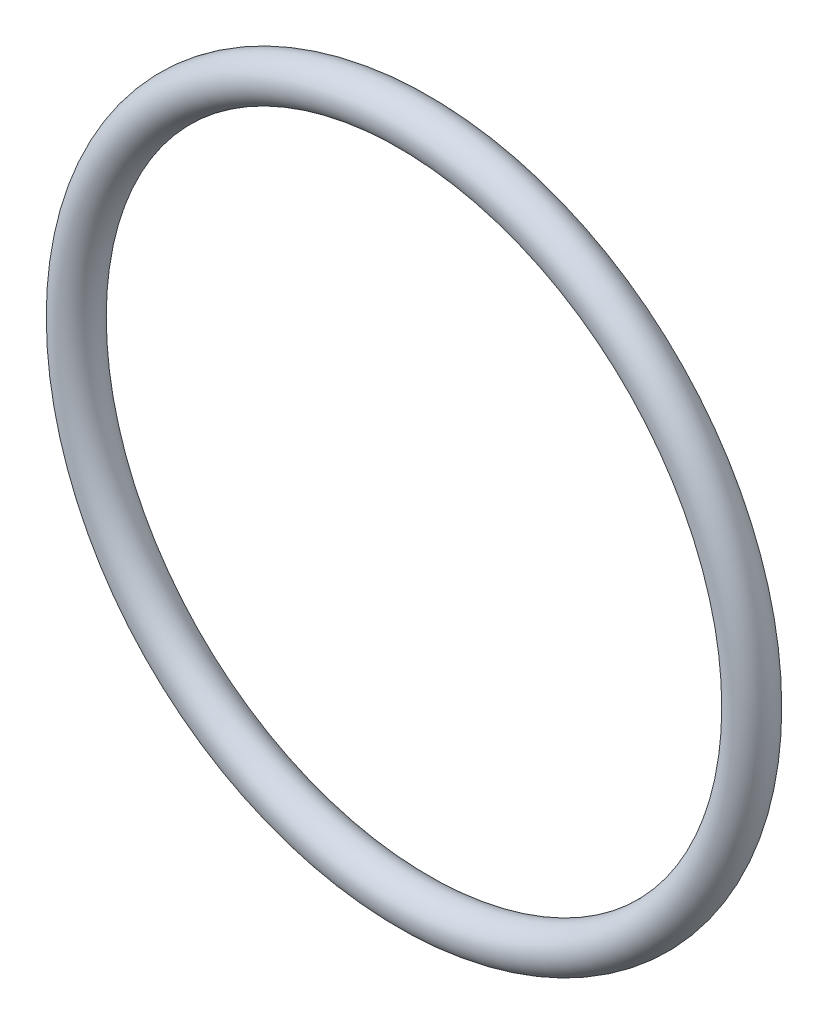
from build123d import *

# Parameters (mm, degrees)
SKETCH3_R = 2


with BuildPart() as part:
    # Sweep1: sweep along a path in Sketch2
    with BuildLine(Plane.XY) as sweep1_path:
        CenterArc((14.028286003, 0), 31.83098862, 0, 360)
    # Sketch3 → Sweep1 (sweep)
    with BuildSketch(Plane(origin=(0, 0, 0), x_dir=(1, 0, 0), z_dir=(0, 1, 0))):
        with Locations((-17.802702617, 0)):
            Circle(SKETCH3_R)
    sweep(path=sweep1_path.line)


solid = part.part
